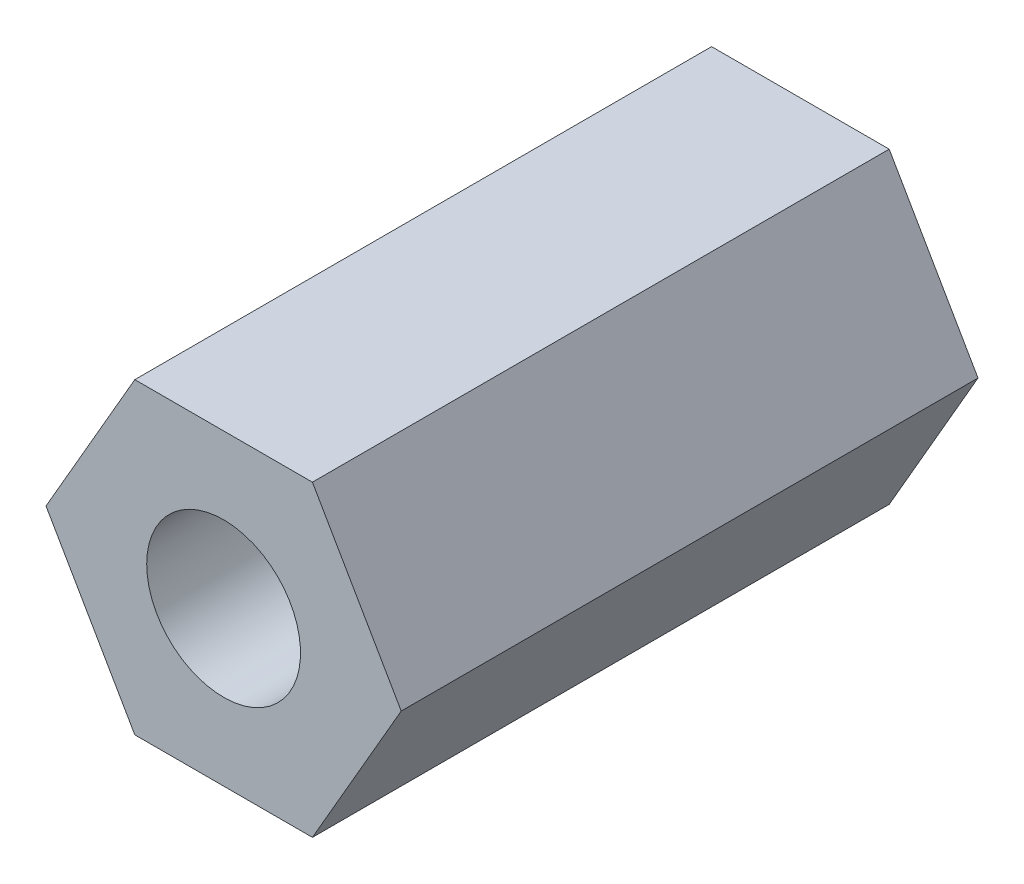
from build123d import *

# Parameters (mm, degrees)
EXTRUDE_1_DEPTH        = 6
HOLE_WIZARD_M2_1_D     = 1.6
HOLE_WIZARD_M2_1_DEPTH = 6
HOLE_WIZARD_M2_1_TIP   = 0.480688495


with BuildPart() as part:
    # 草图1 → 拉伸1 (new body)
    with BuildSketch(Plane.XY):
        Polygon((0.923760431, -1.6), (1.847520861, 0), (0.923760431, 1.6), (-0.923760431, 1.6), (-1.847520861, 0), (-0.923760431, -1.6), align=None)
    extrude(amount=EXTRUDE_1_DEPTH)

    # M2 螺纹孔1
    with Locations(Plane(origin=(0, 0, 0), x_dir=(-1, 0, 0), z_dir=(0, 0, -1))):
        with Locations((0, 0)):
            Hole(HOLE_WIZARD_M2_1_D / 2, depth=HOLE_WIZARD_M2_1_DEPTH)
            with Locations((0, 0, -(HOLE_WIZARD_M2_1_DEPTH + HOLE_WIZARD_M2_1_TIP / 2))):  # 118° drill point
                Cone(0, HOLE_WIZARD_M2_1_D / 2, HOLE_WIZARD_M2_1_TIP, mode=Mode.SUBTRACT)


solid = part.part
